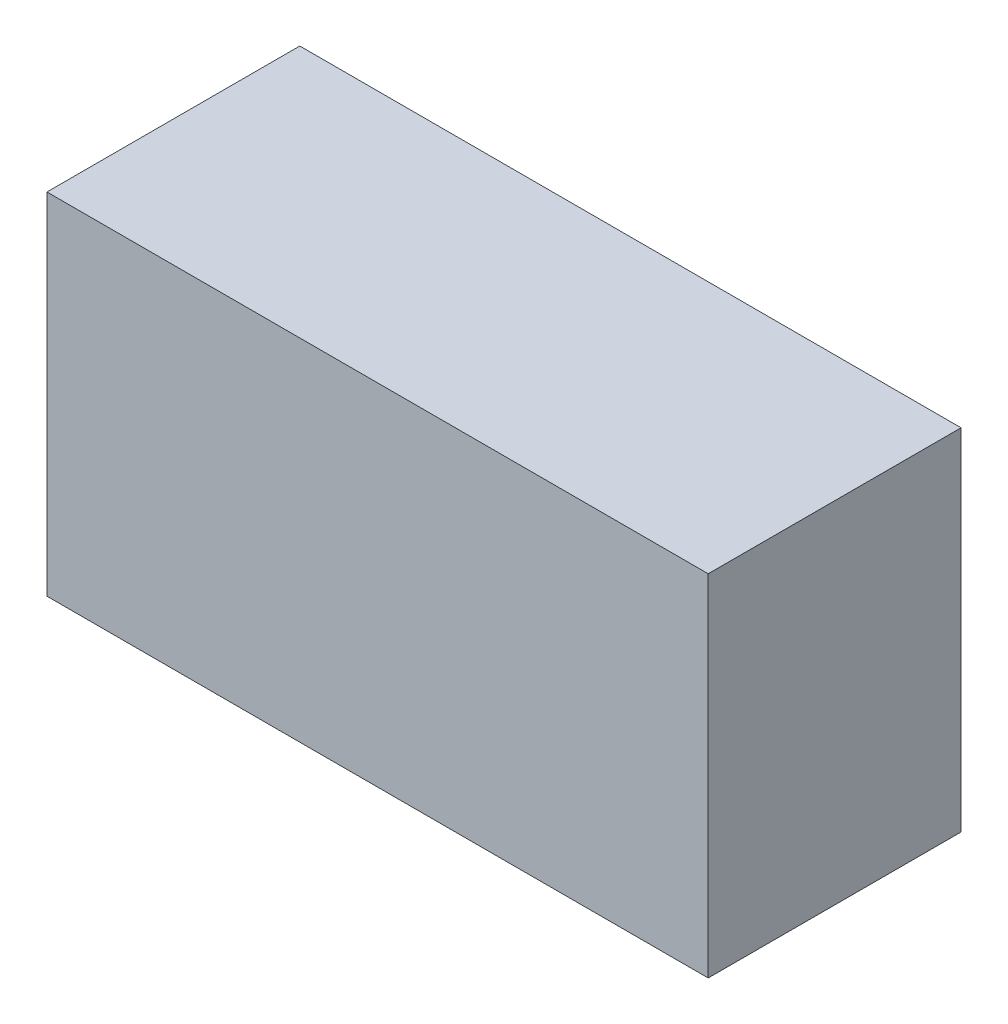
from build123d import *

# Parameters (mm, degrees)
SKETCH1_W      = 51
SKETCH1_H      = 27
ENVELOPE_DEPTH = 19.5


with BuildPart() as part:
    # Sketch1 → Envelope (new body)
    with BuildSketch(Plane.XY):
        Rectangle(SKETCH1_W, SKETCH1_H)
    extrude(amount=ENVELOPE_DEPTH)


solid = part.part
